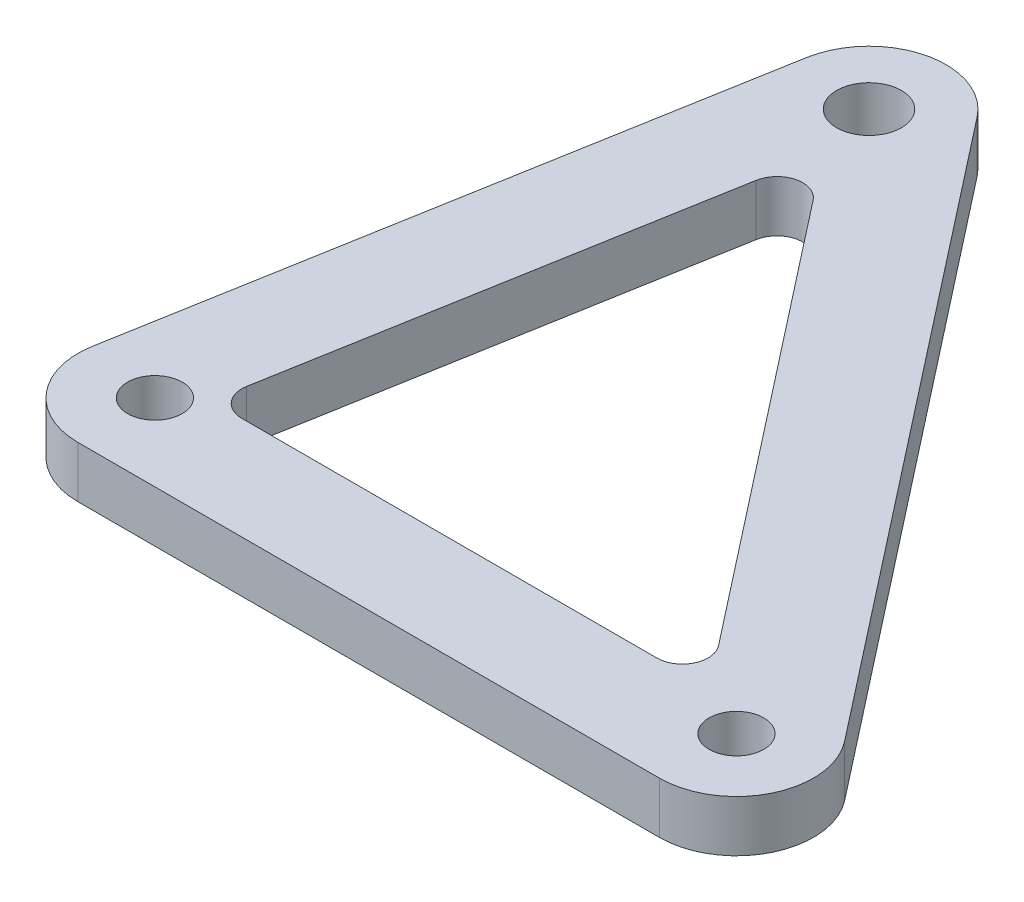
from build123d import *

# Parameters (mm, degrees)
SKETCH1_R           = 3.3782
SKETCH1_R_2         = 9.525
SKETCH1_R_3         = 4
BOSS_EXTRUDE2_DEPTH = 6.35


with BuildPart() as part:
    # Sketch1 → Boss-Extrude2 (new body)
    # profile 1 of 4: a face of its own
    with BuildSketch(Plane(origin=(0, 0, 0), x_dir=(1, 0, 0), z_dir=(0, 1, 0))):
        with BuildLine():
            ThreePointArc((22.747360424, 75.044048297), (12.392810408, 65.555240586), (3.84185454, 76.696844221))
            Line((3.84185454, 76.696844221), (-9.380506141, 1.652794466))
            ThreePointArc((-9.380506141, 1.652794466), (-4.066336445, 8.613392648), (4.685105466, 8.293094222))
            Line((4.685105466, 8.293094222), (13.874736256, 60.449220264))
            ThreePointArc((13.874736256, 60.449220264), (16.232904863, 62.978836655), (19.503039878, 61.853609899))
            Line((19.503039878, 61.853609899), (61.360100888, 8.305321319))
            ThreePointArc((61.360100888, 8.305321319), (61.712469519, 4.958511622), (58.858632611, 3.175))
            Line((58.858632611, 3.175), (8.980256121, 3.175))
            ThreePointArc((8.980256121, 3.175), (9.387826281, 1.610696347), (9.525, 0))
            ThreePointArc((9.525, 0), (6.735192091, -6.735192091), (0, -9.525))
            Line((0, -9.525), (71.882, -9.525))
            ThreePointArc((71.882, -9.525), (63.320489429, 4.174465444), (79.386405256, 5.865963413))
            Line((79.386405256, 5.865963413), (20.726765648, 80.910011751))
            ThreePointArc((20.726765648, 80.910011751), (22.228055421, 78.14615768), (22.747360424, 75.044048297))
        make_face()
    # profile 2 of 4: a face of its own
    with BuildSketch(Plane(origin=(0, 0, 0), x_dir=(1, 0, 0), z_dir=(0, 1, 0))):
        with BuildLine():
            ThreePointArc((4.685105466, 8.293094222), (-4.066336445, 8.613392648), (-9.380506141, 1.652794466))
            ThreePointArc((-9.380506141, 1.652794466), (-7.296180243, -6.123020403), (0, -9.525))
            ThreePointArc((0, -9.525), (6.735192091, -6.735192091), (9.525, 0))
            ThreePointArc((9.525, 0), (9.387826281, 1.610696347), (8.980256121, 3.175))
            Line((8.980256121, 3.175), (7.566649209, 3.175))
            ThreePointArc((7.566649209, 3.175), (5.134589064, 4.308993275), (4.439813863, 6.900931684))
            Line((4.439813863, 6.900931684), (4.685105466, 8.293094222))
        make_face()
        with Locations(Location((0, 0, 0), (0, 0, 270))):
            Circle(SKETCH1_R, mode=Mode.SUBTRACT)
    # profile 3 of 4: a face of its own
    with BuildSketch(Plane(origin=(0, 0, 0), x_dir=(1, 0, 0), z_dir=(0, 1, 0))):
        with Locations((71.882, 0)):
            Circle(SKETCH1_R_2)
        with Locations(Location((71.882, 0, 0), (0, 0, 270))):
            Circle(SKETCH1_R, mode=Mode.SUBTRACT)
    # profile 4 of 4: a face of its own
    with BuildSketch(Plane(origin=(0, 0, 0), x_dir=(1, 0, 0), z_dir=(0, 1, 0))):
        with Locations((13.222360424, 75.044048297)):
            Circle(SKETCH1_R_2)
        with Locations(Location((13.222360424, 75.044048297, 0), (0, 0, 270))):
            Circle(SKETCH1_R_3, mode=Mode.SUBTRACT)
    extrude(amount=BOSS_EXTRUDE2_DEPTH)


solid = part.part
